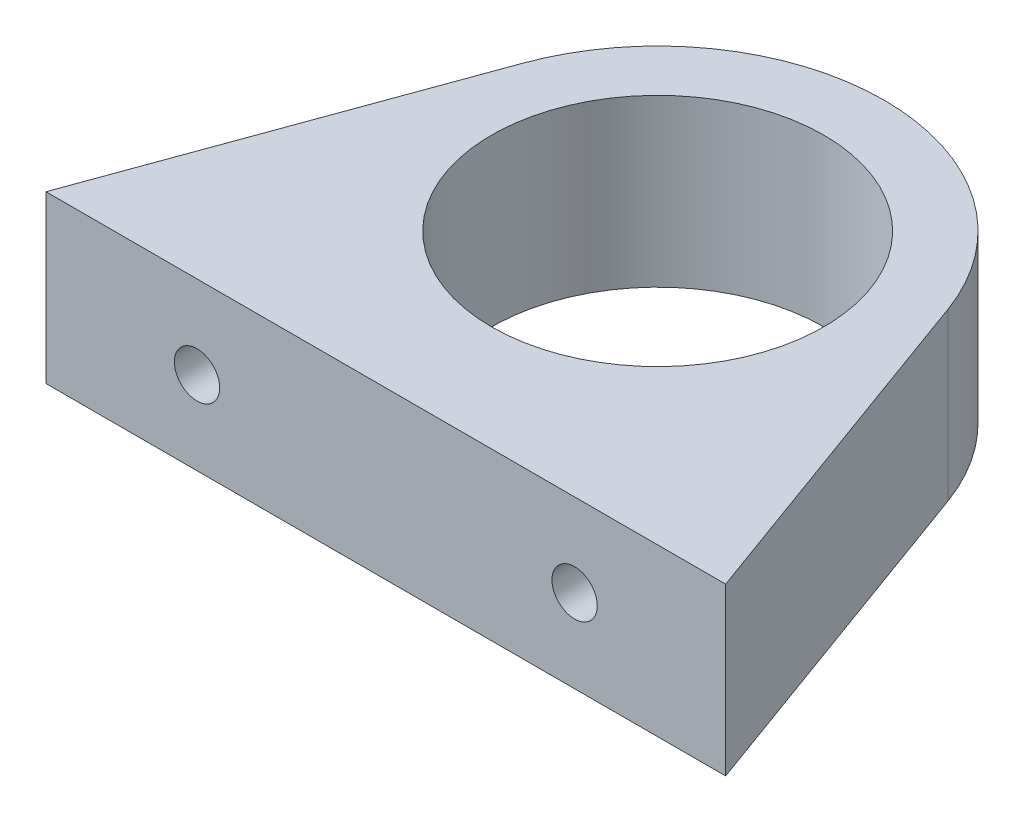
from build123d import *

# Parameters (mm, degrees)
SKETCH1_R                    = 15
SKETCH1_R_2                  = 11
BOSS_EXTRUDE1_DEPTH          = 11
BOSS_EXTRUDE2_DEPTH          = 11
F_3_0_3_DIAMETER_HOLE1_D     = 3
F_3_0_3_DIAMETER_HOLE1_DEPTH = 9.098709071
F_3_0_3_DIAMETER_HOLE1_TIP   = 0.901290929


with BuildPart() as part:
    # Sketch1 → Boss-Extrude1 (new body)
    with BuildSketch(Plane(origin=(0, 0, 0), x_dir=(1, 0, 0), z_dir=(0, 1, 0))):
        with Locations(Location((0, 0, 0), (0, 0, 270))):
            Circle(SKETCH1_R)
        with Locations(Location((0, 0, 0), (0, 0, 270))):
            Circle(SKETCH1_R_2, mode=Mode.SUBTRACT)
    extrude(amount=BOSS_EXTRUDE1_DEPTH)

    # Sketch2 → Boss-Extrude2 (add)
    with BuildSketch(Plane(origin=(0, 0, 0), x_dir=(1, 0, 0), z_dir=(0, 1, 0))):
        with BuildLine():
            Line((-22.5, -18), (-14.098155837, 5.122694797))
            ThreePointArc((-14.098155837, 5.122694797), (0, -15), (14.098155837, 5.122694797))
            Line((14.098155837, 5.122694797), (22.5, -18))
            Line((22.5, -18), (-22.5, -18))
        make_face()
    extrude(amount=BOSS_EXTRUDE2_DEPTH)

    # Ø3.0 (3) Diameter Hole1
    with Locations(Plane.XY.offset(18)):
        with Locations((-12.5, 5.5), (12.5, 5.5)):
            Hole(F_3_0_3_DIAMETER_HOLE1_D / 2, depth=F_3_0_3_DIAMETER_HOLE1_DEPTH)
            with Locations((0, 0, -(F_3_0_3_DIAMETER_HOLE1_DEPTH + F_3_0_3_DIAMETER_HOLE1_TIP / 2))):  # 118° drill point
                Cone(0, F_3_0_3_DIAMETER_HOLE1_D / 2, F_3_0_3_DIAMETER_HOLE1_TIP, mode=Mode.SUBTRACT)


solid = part.part
